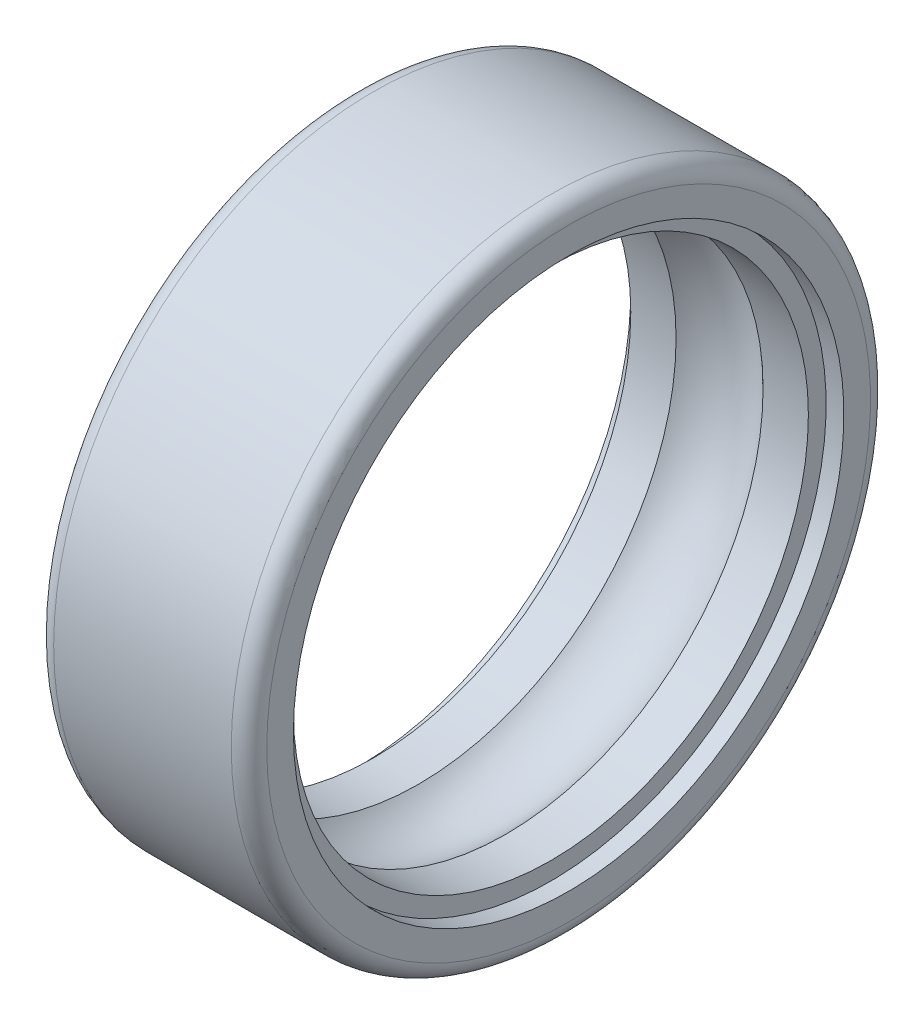
from build123d import *

# Parameters (mm, degrees)
CUT_EXTRUDE1_START = -1
SKETCH3_R          = 15.5
SKETCH3_R_2        = 14.5
CUT_EXTRUDE1_DEPTH = 1


with BuildPart() as part:
    # Sketch2 → Revolve1 (revolve)
    with BuildSketch(Plane.XY, mode=Mode.PRIVATE) as revolve1_sk:
        with BuildLine():
            Line((-6, 14.5), (-2.449489743, 14.5))
            ThreePointArc((-2.449489743, 14.5), (0, 15.5), (2.449489743, 14.5))
            Line((2.449489743, 14.5), (6, 14.5))
            Line((6, 14.5), (6, 17))
            ThreePointArc((6, 17), (5.707106781, 17.707106781), (5, 18))
            Line((5, 18), (-5, 18))
            ThreePointArc((-5, 18), (-5.707106781, 17.707106781), (-6, 17))
            Line((-6, 17), (-6, 14.5))
        make_face()
    revolve(revolve1_sk.sketch.rotate(Axis((-6, 0, 0), (1, 0, 0)), 90), axis=Axis((-6, 0, 0), (1, 0, 0)))

    # Sketch3 → Cut-Extrude1 (cut)
    with BuildSketch(Plane.ZY.offset(6).offset(CUT_EXTRUDE1_START)):
        Circle(SKETCH3_R)
        Circle(SKETCH3_R_2, mode=Mode.SUBTRACT)
    cut_extrude1 = extrude(amount=CUT_EXTRUDE1_DEPTH, mode=Mode.SUBTRACT)

    # Mirror1: Cut-Extrude1 across plane
    add(cut_extrude1.mirror(Plane(origin=(0, 0, 0), x_dir=(0, 0, 1), z_dir=(1, 0, 0))), mode=Mode.SUBTRACT)


solid = part.part
